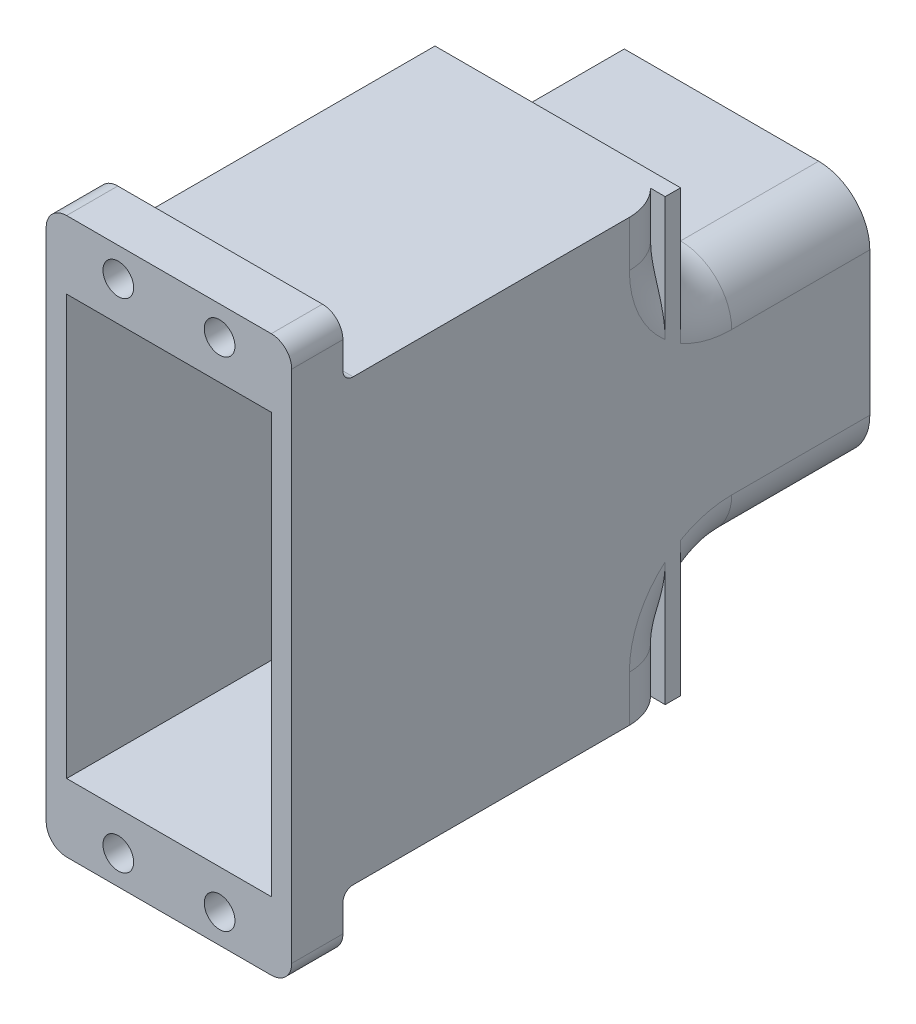
from build123d import *

# Parameters (mm, degrees)
SKETCH_1_W          = 24
SKETCH_1_H          = 24
EXTRUDE_1_DEPTH     = 30
SKETCH_2_W          = 21
SKETCH_2_H          = 21
CUT_EXTRUDE_1_DEPTH = 35.467375879
SKETCH_3_W          = 5
SKETCH_3_H          = 24
EXTRUDE_3_DEPTH     = 2
SKETCH_4_W          = 19
SKETCH_4_H          = 5
EXTRUDE_4_DEPTH     = 2
SKETCH_5_W          = 5
SKETCH_5_H          = 19
EXTRUDE_5_DEPTH     = 2
SKETCH_6_W          = 14
SKETCH_6_H          = 5
EXTRUDE_6_DEPTH     = 2
SKETCH_7_W          = 24
SKETCH_7_H          = 43
EXTRUDE_7_DEPTH     = 28
SKETCH_9_W          = 20
SKETCH_9_H          = 41
CUT_EXTRUDE_2_DEPTH = 27
SKETCH_11_W         = 24
SKETCH_11_H         = 54.3
EXTRUDE_20_DEPTH    = 10
SKETCH_12_W         = 20
SKETCH_12_H         = 41
CUT_EXTRUDE_4_DEPTH = 10
SKETCH_13_R         = 1.5
CUT_EXTRUDE_5_DEPTH = 10
FILLET_2_R          = 5
FILLET_3_R          = 2
CUT_EXTRUDE_START   = -5
CUT_EXTRUDE_6_DEPTH = 5
CUT_EXTRUDE_7_DEPTH = 5
FILLET_4_R          = 1
SKETCH_17_W         = 13.5
SKETCH_17_H         = 24.100930422
CUT_EXTRUDE_8_DEPTH = 45
FILLET_6_R          = 5
EXTRUDE_START       = -1.5
EXTRUDE_23_DEPTH    = 1.5


with BuildPart() as part:
    # 草图1 → 凸台-拉伸1 (new body)
    with BuildSketch(Plane.XY):
        Rectangle(SKETCH_1_W, SKETCH_1_H)
    extrude(amount=EXTRUDE_1_DEPTH)

    # 草图2 → 切除-拉伸1 (cut, through all)
    with BuildSketch(Plane(origin=(0, 0, 0), x_dir=(-1, 0, 0), z_dir=(0, 0, -1))):
        Rectangle(SKETCH_2_W, SKETCH_2_H)
    extrude(amount=-CUT_EXTRUDE_1_DEPTH, mode=Mode.SUBTRACT)

    # 草图3 → 凸台-拉伸3 (add)
    with BuildSketch(Plane.XY.offset(30)):
        with Locations((-9.5, 0)):
            Rectangle(SKETCH_3_W, SKETCH_3_H)
    extrude(amount=EXTRUDE_3_DEPTH)

    # 草图4 → 凸台-拉伸4 (add)
    with BuildSketch(Plane.XY.offset(30)):
        with Locations((2.5, -9.5)):
            Rectangle(SKETCH_4_W, SKETCH_4_H)
    extrude(amount=EXTRUDE_4_DEPTH)

    # 草图5 → 凸台-拉伸5 (add)
    with BuildSketch(Plane.XY.offset(30)):
        with Locations((9.5, 2.5)):
            Rectangle(SKETCH_5_W, SKETCH_5_H)
    extrude(amount=EXTRUDE_5_DEPTH)

    # 草图6 → 凸台-拉伸6 (add)
    with BuildSketch(Plane.XY.offset(30)):
        with Locations((0, 9.5)):
            Rectangle(SKETCH_6_W, SKETCH_6_H)
    extrude(amount=EXTRUDE_6_DEPTH)

    # 草图7 → 凸台-拉伸7 (add)
    with BuildSketch(Plane.XY.offset(32)):
        Rectangle(SKETCH_7_W, SKETCH_7_H)
    extrude(amount=EXTRUDE_7_DEPTH)

    # 草图9 → 切除-拉伸2 (cut)
    with BuildSketch(Plane.XY.offset(60)):
        Rectangle(SKETCH_9_W, SKETCH_9_H)
    extrude(amount=-CUT_EXTRUDE_2_DEPTH, mode=Mode.SUBTRACT)

    # 草图11 → 凸台-拉伸20 (add)
    with BuildSketch(Plane.XY.offset(60)):
        Rectangle(SKETCH_11_W, SKETCH_11_H)
    extrude(amount=EXTRUDE_20_DEPTH)

    # 草图12 → 切除-拉伸4 (cut)
    with BuildSketch(Plane.XY.offset(70)):
        Rectangle(SKETCH_12_W, SKETCH_12_H)
    extrude(amount=-CUT_EXTRUDE_4_DEPTH, mode=Mode.SUBTRACT)

    # 草图13 → 切除-拉伸5 (cut)
    with BuildSketch(Plane.XY.offset(70)):
        with Locations((-4.95, -24.310374207)):
            Circle(SKETCH_13_R)
        with Locations((4.95, -24.310374207)):
            Circle(SKETCH_13_R)
        with Locations(Location((4.95, 24.310374207, 0), (0, 0, 180))):
            Circle(SKETCH_13_R)
        with Locations(Location((-4.95, 24.310374207, 0), (0, 0, 180))):
            Circle(SKETCH_13_R)
    extrude(amount=-CUT_EXTRUDE_5_DEPTH, mode=Mode.SUBTRACT)

    # 圆角2
    fillet_2_edges = [part.edges().sort_by_distance(p)[0] for p in [
        (0, -12, 32),
        (0, 12, 32),
    ]]
    fillet(fillet_2_edges, radius=FILLET_2_R)

    # 圆角3
    fillet_3_edges = [part.edges().sort_by_distance(p)[0] for p in [
        (12, -27.15, 65),
        (12, 27.15, 65),
        (-12, 27.15, 65),
        (-12, -27.15, 65),
    ]]
    fillet(fillet_3_edges, radius=FILLET_3_R)

    # 草图15 → 切除-拉伸6 (cut)
    with BuildSketch(Plane(origin=(0, 0, 60), x_dir=(-1, 0, 0), z_dir=(0, 0, -1)).offset(CUT_EXTRUDE_START)):
        with BuildLine():
            Line((-12, -21.5), (-12, -25.15))
            ThreePointArc((-12, -25.15), (-11.414213562, -26.564213562), (-10, -27.15))
            Line((-10, -27.15), (10, -27.15))
            ThreePointArc((10, -27.15), (11.414213562, -26.564213562), (12, -25.15))
            Line((12, -25.15), (12, -21.5))
            Line((12, -21.5), (-12, -21.5))
        make_face()
    extrude(amount=CUT_EXTRUDE_6_DEPTH, mode=Mode.SUBTRACT)

    # 草图16 → 切除-拉伸7 (cut)
    with BuildSketch(Plane(origin=(0, 0, 60), x_dir=(-1, 0, 0), z_dir=(0, 0, -1)).offset(CUT_EXTRUDE_START)):
        with BuildLine():
            Line((12, 21.5), (12, 25.15))
            ThreePointArc((12, 25.15), (11.414213562, 26.564213562), (10, 27.15))
            Line((10, 27.15), (-10, 27.15))
            ThreePointArc((-10, 27.15), (-11.414213562, 26.564213562), (-12, 25.15))
            Line((-12, 25.15), (-12, 21.5))
            Line((-12, 21.5), (12, 21.5))
        make_face()
    extrude(amount=CUT_EXTRUDE_7_DEPTH, mode=Mode.SUBTRACT)

    # 圆角4
    fillet_4_edges = [part.edges().sort_by_distance(p)[0] for p in [
        (0, -21.5, 65),
        (0, 21.5, 65),
    ]]
    fillet(fillet_4_edges, radius=FILLET_4_R)

    # 草图17 → 切除-拉伸8 (cut)
    with BuildSketch(Plane.ZY.offset(12)):
        with Locations((6.75, 0.050465211)):
            Rectangle(SKETCH_17_W, SKETCH_17_H)
    extrude(amount=-CUT_EXTRUDE_8_DEPTH, mode=Mode.SUBTRACT)

    # 圆角6
    fillet_6_edges = [part.edges().sort_by_distance(p)[0] for p in [
        (12, -12, 20.25),
        (12, 19.25, 32),
        (12, 12, 20.25),
        (12, -13.464466094, 30.535533906),
        (12, 13.464466094, 30.535533906),
        (12, -19.25, 32),
    ]]
    fillet(fillet_6_edges, radius=FILLET_6_R)

    # 草图27 → 凸台-拉伸23 (add)
    with BuildSketch(Plane(origin=(0, 0, 32), x_dir=(-1, 0, 0), z_dir=(0, 0, -1)).offset(EXTRUDE_START)):
        Polygon((-12, 17), (-12, 3.059411708), (-12, -3.059411708), (-12, -17), (-12, -21.5), (12, -21.5), (12, 21.5), (-12, 21.5), align=None)
    extrude(amount=EXTRUDE_23_DEPTH)


solid = part.part
